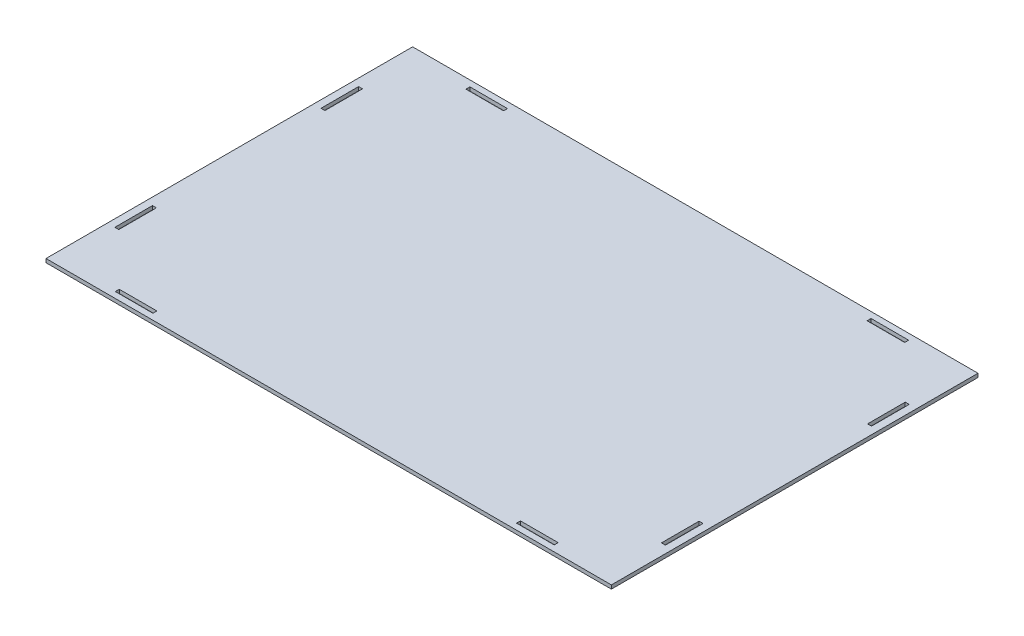
from build123d import *

# Parameters (mm, degrees)
CROQUIS1_W              = 455
CROQUIS1_H              = 297
SALIENTE_EXTRUIR1_DEPTH = 1.5
CROQUIS2_W              = 30.5
CROQUIS2_H              = 3.2
CROQUIS2_W_2            = 3.2
CROQUIS2_H_2            = 30.5
CORTAR_EXTRUIR1_DEPTH   = 5
CROQUIS3_W              = 297
CROQUIS3_H              = 3
SALIENTE_EXTRUIR2_DEPTH = 1.5


with BuildPart() as part:
    # Croquis1 → Saliente-Extruir1 (new, symmetric)
    with BuildSketch(Plane(origin=(0, 0, 0), x_dir=(1, 0, 0), z_dir=(0, 1, 0))):
        Rectangle(CROQUIS1_W, CROQUIS1_H)
    extrude(amount=SALIENTE_EXTRUIR1_DEPTH, both=True)

    # Croquis2 → Cortar-Extruir1 (cut, symmetric)
    with BuildSketch(Plane(origin=(0, 1.5, 0), x_dir=(1, 0, 0), z_dir=(0, 1, 0))):
        with Locations((-162.5, -142)):
            Rectangle(CROQUIS2_W, CROQUIS2_H)
        with Locations((-221.4, -83.5)):
            Rectangle(CROQUIS2_W_2, CROQUIS2_H_2)
        with Locations((221.4, -83.5)):
            Rectangle(CROQUIS2_W_2, CROQUIS2_H_2)
        with Locations((162.5, -142)):
            Rectangle(CROQUIS2_W, CROQUIS2_H)
        with Locations((162.5, 142)):
            Rectangle(CROQUIS2_W, CROQUIS2_H)
        with Locations((221.4, 83.5)):
            Rectangle(CROQUIS2_W_2, CROQUIS2_H_2)
        with Locations((-221.4, 83.5)):
            Rectangle(CROQUIS2_W_2, CROQUIS2_H_2)
        with Locations((-162.5, 142)):
            Rectangle(CROQUIS2_W, CROQUIS2_H)
    extrude(amount=CORTAR_EXTRUIR1_DEPTH, both=True, mode=Mode.SUBTRACT)

    # Croquis3 → Saliente-Extruir2 (add)
    with BuildSketch(Plane.ZY.offset(227.5)):
        Rectangle(CROQUIS3_W, CROQUIS3_H)
    saliente_extruir2 = extrude(amount=SALIENTE_EXTRUIR2_DEPTH)

    # Simetría1: Saliente-Extruir2 across plane
    add(saliente_extruir2.mirror(Plane(origin=(0, 0, 0), x_dir=(0, 0, 1), z_dir=(1, 0, 0))))


solid = part.part
